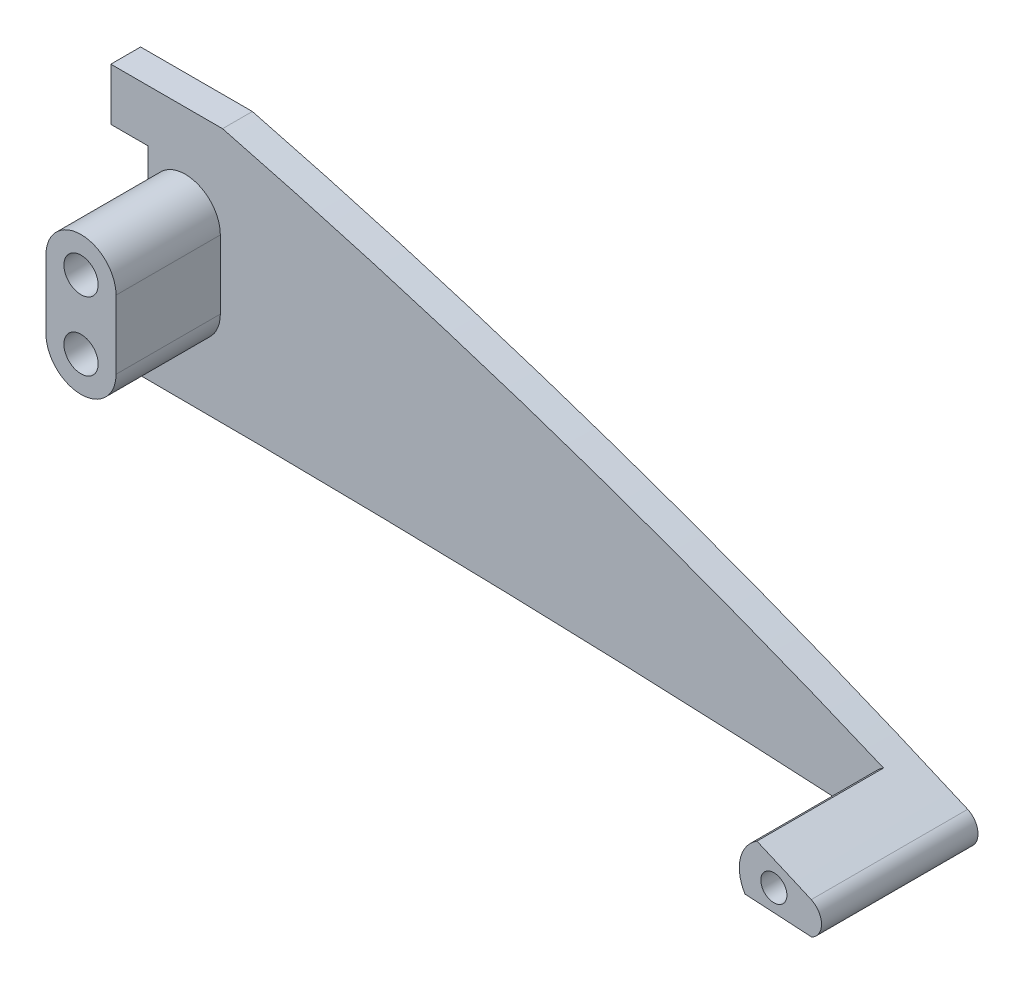
from build123d import *

# Parameters (mm, degrees)
SZKIC2_R                    = 2.3
DODANIE_WYCI_GNI_CIE1_DEPTH = 4
SZKIC3_R                    = 1.75
DODANIE_WYCI_GNI_CIE2_DEPTH = 17
DODANIE_WYCI_GNI_CIE3_DEPTH = 14
SZKIC6_R                    = 2.3
SZKIC6_R_2                  = 1.75
WYTNIJ_WYCI_GNI_CIE2_DEPTH  = 131.905876654


with BuildPart() as part:
    # Szkic2 → Dodanie-wyciągnięcie1 (new body)
    with BuildSketch(Plane.XY):
        with BuildLine():
            Line((15.2, 17.1), (15.2, 10.1))
            Line((15.2, 10.1), (20.2, 10.1))
            Line((20.2, 10.1), (20.2, -10.1))
            Line((20.2, -10.1), (15.2, -10.1))
            Line((15.2, -10.1), (15.2, -17.1))
            Line((15.2, -17.1), (19.197379501, -17.1))
            ThreePointArc((19.197379501, -17.1), (72.757727431, -17.908543704), (126.269263581, -20.333437957))
            ThreePointArc((126.269263581, -20.333437957), (127.600370297, -18.154974458), (126.216652739, -16.009543491))
            ThreePointArc((126.216652739, -16.009543491), (78.887653554, 2.515256091), (30.2, 17.1))
            Line((30.2, 17.1), (15.2, 17.1))
        make_face()
        with Locations(Location((25.2, 4.6, 0), (0, 0, 180))):
            Circle(SZKIC2_R, mode=Mode.SUBTRACT)
        with Locations((25.2, -4.6)):
            Circle(SZKIC2_R, mode=Mode.SUBTRACT)
    extrude(amount=DODANIE_WYCI_GNI_CIE1_DEPTH)

    # Szkic3 → Dodanie-wyciągnięcie2 (add)
    with BuildSketch(Plane.XY.offset(4)):
        with BuildLine():
            ThreePointArc((126.269263581, -20.333437957), (121.801544753, -20.069007105), (117.33317317, -19.815845914))
            ThreePointArc((117.33317317, -19.815845914), (116.687057134, -16.008461108), (118.922411718, -12.859360463))
            ThreePointArc((118.922411718, -12.859360463), (122.574580097, -14.42276365), (126.216652739, -16.009543491))
            ThreePointArc((126.216652739, -16.009543491), (127.600370297, -18.154974458), (126.269263581, -20.333437957))
        make_face()
        with Locations((121.2, -17.133437957)):
            Circle(SZKIC3_R, mode=Mode.SUBTRACT)
    extrude(amount=DODANIE_WYCI_GNI_CIE2_DEPTH)

    # Szkic5 → Dodanie-wyciągnięcie3 (add)
    with BuildSketch(Plane.XY.offset(4)):
        with BuildLine():
            Line((20.5, -4.6), (20.5, 4.6))
            ThreePointArc((20.5, 4.6), (25.2, 9.3), (29.9, 4.6))
            Line((29.9, 4.6), (29.9, -4.6))
            ThreePointArc((29.9, -4.6), (25.2, -9.3), (20.5, -4.6))
        make_face()
    extrude(amount=DODANIE_WYCI_GNI_CIE3_DEPTH)

    # Szkic6 → Wytnij-wyciągnięcie2 (cut, through all)
    with BuildSketch(Plane(origin=(0, 0, 0), x_dir=(-1, 0, 0), z_dir=(0, 0, -1))):
        with Locations(Location((-25.2, -4.6, 0), (0, 0, 180))):
            Circle(SZKIC6_R)
        with Locations((-25.2, 4.6)):
            Circle(SZKIC6_R)
        with Locations((-121.2, -17.133437957)):
            Circle(SZKIC6_R_2)
    extrude(amount=-WYTNIJ_WYCI_GNI_CIE2_DEPTH, mode=Mode.SUBTRACT)


solid = part.part
